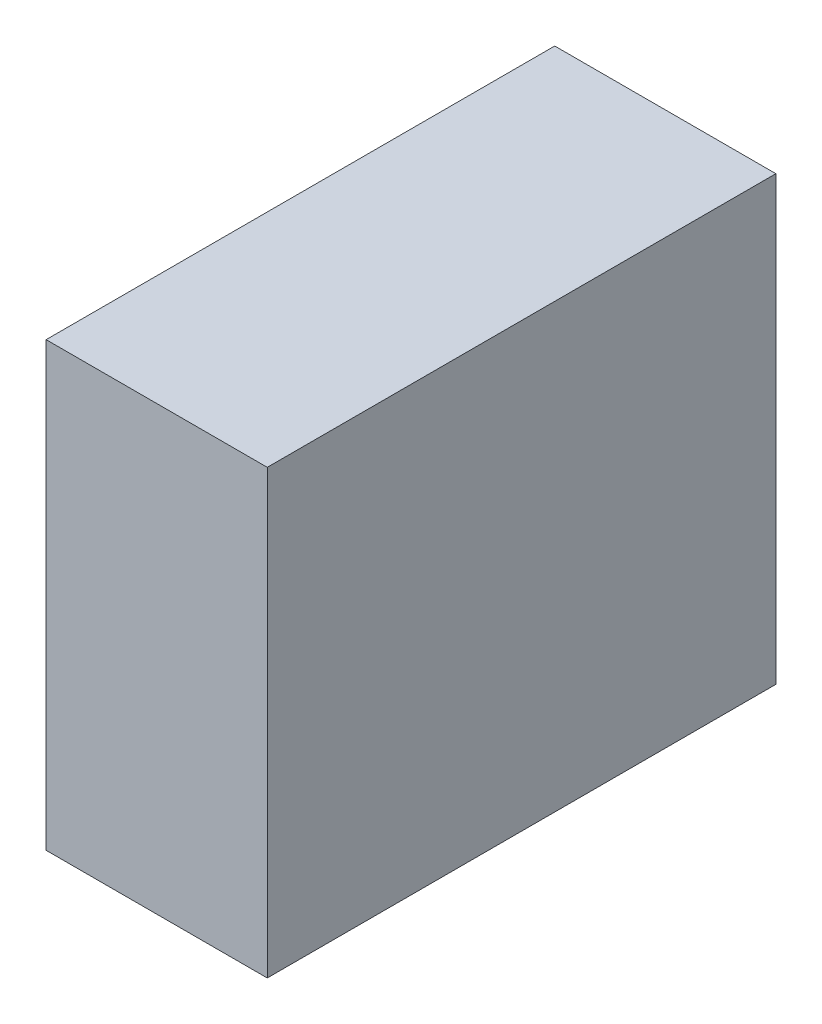
from build123d import *

# Parameters (mm, degrees)
SKETCH1_W           = 23
SKETCH1_H           = 20
BOSS_EXTRUDE1_DEPTH = 10


with BuildPart() as part:
    # Sketch1 → Boss-Extrude1 (new body)
    with BuildSketch(Plane(origin=(0, 0, 0), x_dir=(0, 0, -1), z_dir=(1, 0, 0))):
        with Locations((11.5, 10)):
            Rectangle(SKETCH1_W, SKETCH1_H)
    extrude(amount=BOSS_EXTRUDE1_DEPTH)


solid = part.part
